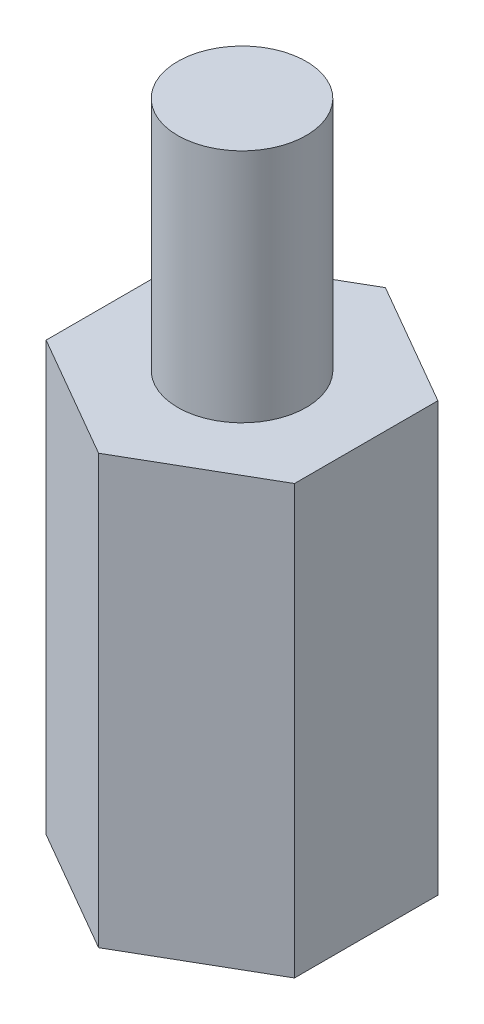
from build123d import *

# Parameters (mm, degrees)
SKETCH1_R           = 1.5
BOSS_EXTRUDE1_DEPTH = 5
SKETCH2_R           = 1.5
BOSS_EXTRUDE2_DEPTH = 5.5


with BuildPart() as part:
    # Sketch1 → Boss-Extrude1 (new, symmetric)
    with BuildSketch(Plane(origin=(0, 0, 0), x_dir=(1, 0, 0), z_dir=(0, 1, 0))):
        Polygon((0, -3.348631561), (2.9, -1.674315781), (2.9, 1.674315781), (0, 3.348631561), (-2.9, 1.674315781), (-2.9, -1.674315781), align=None)
        with Locations(Location((0, 0, 0), (0, 0, 270))):
            Circle(SKETCH1_R, mode=Mode.SUBTRACT)
    extrude(amount=BOSS_EXTRUDE1_DEPTH, both=True)


with BuildPart() as body_2:
    # Sketch2 → Boss-Extrude2 (new body)
    with BuildSketch(Plane(origin=(0, 5, 0), x_dir=(1, 0, 0), z_dir=(0, 1, 0))):
        with Locations(Location((0, 0, 0), (0, 0, 270))):
            Circle(SKETCH2_R)
    extrude(amount=BOSS_EXTRUDE2_DEPTH)


solid = Compound([part.part, body_2.part])
